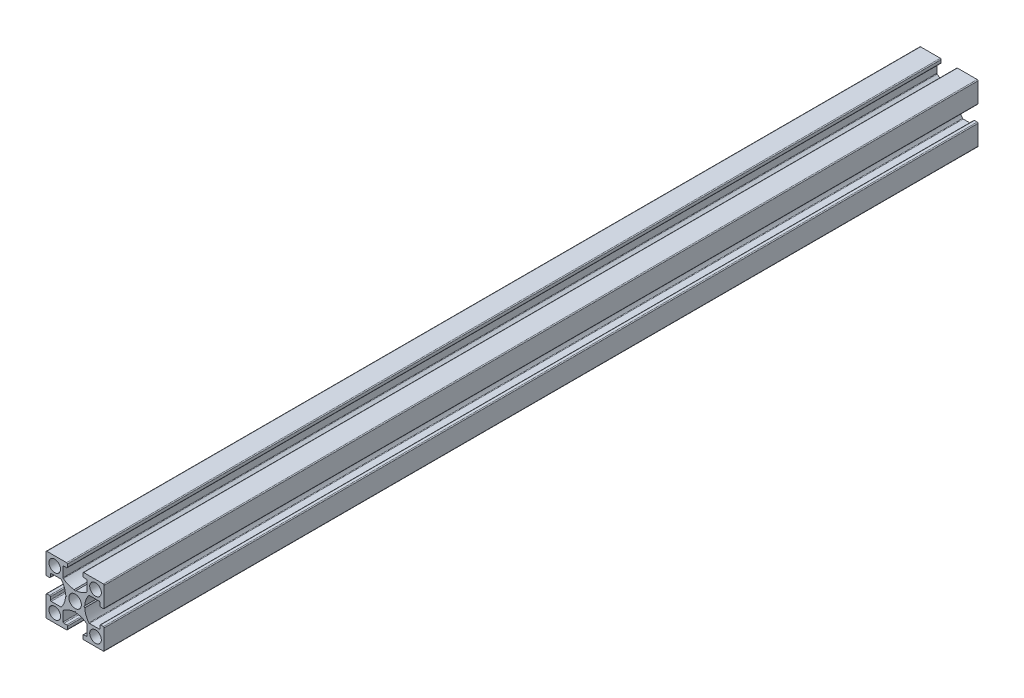
from build123d import *

# Parameters (mm, degrees)
MODEL_R         = 2.15
MODEL_R_2       = 2
EXTRUDE_1_DEPTH = 300


with BuildPart() as part:
    # Model → 보스-돌출1 (new body)
    with BuildSketch(Plane.XY):
        with BuildLine():
            Line((2307.763927197, 1192.134297913), (2307.763927197, 1195.391548465))
            ThreePointArc((2307.763927197, 1195.391548465), (2307.676059232, 1195.603680499), (2307.463927197, 1195.691548465))
            Line((2307.463927197, 1195.691548465), (2306.563927197, 1195.691548465))
            ThreePointArc((2306.563927197, 1195.691548465), (2306.351795163, 1195.779416431), (2306.263927197, 1195.991548465))
            Line((2306.263927197, 1195.991548465), (2306.263927197, 1196.891548465))
            ThreePointArc((2306.263927197, 1196.891548465), (2306.351795163, 1197.103680499), (2306.563927197, 1197.191548465))
            Line((2306.563927197, 1197.191548465), (2313.313927197, 1197.191548465))
            ThreePointArc((2313.313927197, 1197.191548465), (2313.526059232, 1197.103680499), (2313.613927197, 1196.891548465))
            Line((2313.613927197, 1196.891548465), (2313.613927197, 1190.141548465))
            ThreePointArc((2313.613927197, 1190.141548465), (2313.526059232, 1189.929416431), (2313.313927197, 1189.841548465))
            Line((2313.313927197, 1189.841548465), (2312.413927197, 1189.841548465))
            ThreePointArc((2312.413927197, 1189.841548465), (2312.201795163, 1189.929416431), (2312.113927197, 1190.141548465))
            Line((2312.113927197, 1190.141548465), (2312.113927197, 1191.041548465))
            ThreePointArc((2312.113927197, 1191.041548465), (2312.026059232, 1191.253680499), (2311.813927197, 1191.341548465))
            Line((2311.813927197, 1191.341548465), (2308.556676645, 1191.341548465))
            ThreePointArc((2308.556676645, 1191.341548465), (2308.426234796, 1191.311705686), (2308.321744595, 1191.228114625))
            ThreePointArc((2308.321744595, 1191.228114625), (2307.328306374, 1189.47356999), (2306.921204563, 1187.498825831))
            Line((2306.921204563, 1187.498825831), (2306.613927197, 1187.191548465))
            Line((2306.613927197, 1187.191548465), (2306.921204563, 1186.884271099))
            ThreePointArc((2306.921204563, 1186.884271099), (2307.328306374, 1184.90952694), (2308.321744595, 1183.154982305))
            ThreePointArc((2308.321744595, 1183.154982305), (2308.426234796, 1183.071391244), (2308.556676645, 1183.041548465))
            Line((2308.556676645, 1183.041548465), (2311.813927197, 1183.041548465))
            ThreePointArc((2311.813927197, 1183.041548465), (2312.026059232, 1183.129416431), (2312.113927197, 1183.341548465))
            Line((2312.113927197, 1183.341548465), (2312.113927197, 1184.241548465))
            ThreePointArc((2312.113927197, 1184.241548465), (2312.201795163, 1184.453680499), (2312.413927197, 1184.541548465))
            Line((2312.413927197, 1184.541548465), (2313.313927197, 1184.541548465))
            ThreePointArc((2313.313927197, 1184.541548465), (2313.526059232, 1184.453680499), (2313.613927197, 1184.241548465))
            Line((2313.613927197, 1184.241548465), (2313.613927197, 1177.491548465))
            ThreePointArc((2313.613927197, 1177.491548465), (2313.526059232, 1177.279416431), (2313.313927197, 1177.191548465))
            Line((2313.313927197, 1177.191548465), (2306.563927197, 1177.191548465))
            ThreePointArc((2306.563927197, 1177.191548465), (2306.351795163, 1177.279416431), (2306.263927197, 1177.491548465))
            Line((2306.263927197, 1177.491548465), (2306.263927197, 1178.391548465))
            ThreePointArc((2306.263927197, 1178.391548465), (2306.351795163, 1178.603680499), (2306.563927197, 1178.691548465))
            Line((2306.563927197, 1178.691548465), (2307.463927197, 1178.691548465))
            ThreePointArc((2307.463927197, 1178.691548465), (2307.676059232, 1178.779416431), (2307.763927197, 1178.991548465))
            Line((2307.763927197, 1178.991548465), (2307.763927197, 1182.248799017))
            ThreePointArc((2307.763927197, 1182.248799017), (2307.734084418, 1182.379240866), (2307.650493357, 1182.483731067))
            ThreePointArc((2307.650493357, 1182.483731067), (2305.895948722, 1183.477169289), (2303.921204563, 1183.884271099))
            Line((2303.921204563, 1183.884271099), (2303.613927197, 1184.191548465))
            Line((2303.613927197, 1184.191548465), (2303.306649831, 1183.884271099))
            ThreePointArc((2303.306649831, 1183.884271099), (2301.331905673, 1183.477169289), (2299.577361038, 1182.483731067))
            ThreePointArc((2299.577361038, 1182.483731067), (2299.493769977, 1182.379240866), (2299.463927197, 1182.248799017))
            Line((2299.463927197, 1182.248799017), (2299.463927197, 1178.991548465))
            ThreePointArc((2299.463927197, 1178.991548465), (2299.551795163, 1178.779416431), (2299.763927197, 1178.691548465))
            Line((2299.763927197, 1178.691548465), (2300.663927197, 1178.691548465))
            ThreePointArc((2300.663927197, 1178.691548465), (2300.876059232, 1178.603680499), (2300.963927197, 1178.391548465))
            Line((2300.963927197, 1178.391548465), (2300.963927197, 1177.491548465))
            ThreePointArc((2300.963927197, 1177.491548465), (2300.876059232, 1177.279416431), (2300.663927197, 1177.191548465))
            Line((2300.663927197, 1177.191548465), (2293.913927197, 1177.191548465))
            ThreePointArc((2293.913927197, 1177.191548465), (2293.701795163, 1177.279416431), (2293.613927197, 1177.491548465))
            Line((2293.613927197, 1177.491548465), (2293.613927197, 1184.241548465))
            ThreePointArc((2293.613927197, 1184.241548465), (2293.701795163, 1184.453680499), (2293.913927197, 1184.541548465))
            Line((2293.913927197, 1184.541548465), (2294.813927197, 1184.541548465))
            ThreePointArc((2294.813927197, 1184.541548465), (2295.026059232, 1184.453680499), (2295.113927197, 1184.241548465))
            Line((2295.113927197, 1184.241548465), (2295.113927197, 1183.341548465))
            ThreePointArc((2295.113927197, 1183.341548465), (2295.201795163, 1183.129416431), (2295.413927197, 1183.041548465))
            Line((2295.413927197, 1183.041548465), (2298.671177749, 1183.041548465))
            ThreePointArc((2298.671177749, 1183.041548465), (2298.801619599, 1183.071391244), (2298.906109799, 1183.154982305))
            ThreePointArc((2298.906109799, 1183.154982305), (2299.899548021, 1184.90952694), (2300.306649831, 1186.884271099))
            Line((2300.306649831, 1186.884271099), (2300.613927197, 1187.191548465))
            Line((2300.613927197, 1187.191548465), (2300.306649831, 1187.498825831))
            ThreePointArc((2300.306649831, 1187.498825831), (2299.899548021, 1189.47356999), (2298.906109799, 1191.228114625))
            ThreePointArc((2298.906109799, 1191.228114625), (2298.801619599, 1191.311705686), (2298.671177749, 1191.341548465))
            Line((2298.671177749, 1191.341548465), (2295.413927197, 1191.341548465))
            ThreePointArc((2295.413927197, 1191.341548465), (2295.201795163, 1191.253680499), (2295.113927197, 1191.041548465))
            Line((2295.113927197, 1191.041548465), (2295.113927197, 1190.141548465))
            ThreePointArc((2295.113927197, 1190.141548465), (2295.026059232, 1189.929416431), (2294.813927197, 1189.841548465))
            Line((2294.813927197, 1189.841548465), (2293.913927197, 1189.841548465))
            ThreePointArc((2293.913927197, 1189.841548465), (2293.701795163, 1189.929416431), (2293.613927197, 1190.141548465))
            Line((2293.613927197, 1190.141548465), (2293.613927197, 1196.891548465))
            ThreePointArc((2293.613927197, 1196.891548465), (2293.701795163, 1197.103680499), (2293.913927197, 1197.191548465))
            Line((2293.913927197, 1197.191548465), (2300.663927197, 1197.191548465))
            ThreePointArc((2300.663927197, 1197.191548465), (2300.876059232, 1197.103680499), (2300.963927197, 1196.891548465))
            Line((2300.963927197, 1196.891548465), (2300.963927197, 1195.991548465))
            ThreePointArc((2300.963927197, 1195.991548465), (2300.876059232, 1195.779416431), (2300.663927197, 1195.691548465))
            Line((2300.663927197, 1195.691548465), (2299.763927197, 1195.691548465))
            ThreePointArc((2299.763927197, 1195.691548465), (2299.551795163, 1195.603680499), (2299.463927197, 1195.391548465))
            Line((2299.463927197, 1195.391548465), (2299.463927197, 1192.134297913))
            ThreePointArc((2299.463927197, 1192.134297913), (2299.493769977, 1192.003856063), (2299.577361038, 1191.899365863))
            ThreePointArc((2299.577361038, 1191.899365863), (2301.331905673, 1190.905927641), (2303.306649831, 1190.498825831))
            Line((2303.306649831, 1190.498825831), (2303.613927197, 1190.191548465))
            Line((2303.613927197, 1190.191548465), (2303.921204563, 1190.498825831))
            ThreePointArc((2303.921204563, 1190.498825831), (2305.895948722, 1190.905927641), (2307.650493357, 1191.899365863))
            ThreePointArc((2307.650493357, 1191.899365863), (2307.734084418, 1192.003856063), (2307.763927197, 1192.134297913))
        make_face()
        with Locations((2303.613927197, 1187.191548465)):
            Circle(MODEL_R, mode=Mode.SUBTRACT)
        with Locations((2296.613927197, 1194.191548465)):
            Circle(MODEL_R_2, mode=Mode.SUBTRACT)
        with Locations((2296.613927197, 1180.191548465)):
            Circle(MODEL_R_2, mode=Mode.SUBTRACT)
        with Locations((2310.613927197, 1194.191548465)):
            Circle(MODEL_R_2, mode=Mode.SUBTRACT)
        with Locations((2310.613927197, 1180.191548465)):
            Circle(MODEL_R_2, mode=Mode.SUBTRACT)
    extrude(amount=EXTRUDE_1_DEPTH)


solid = part.part
